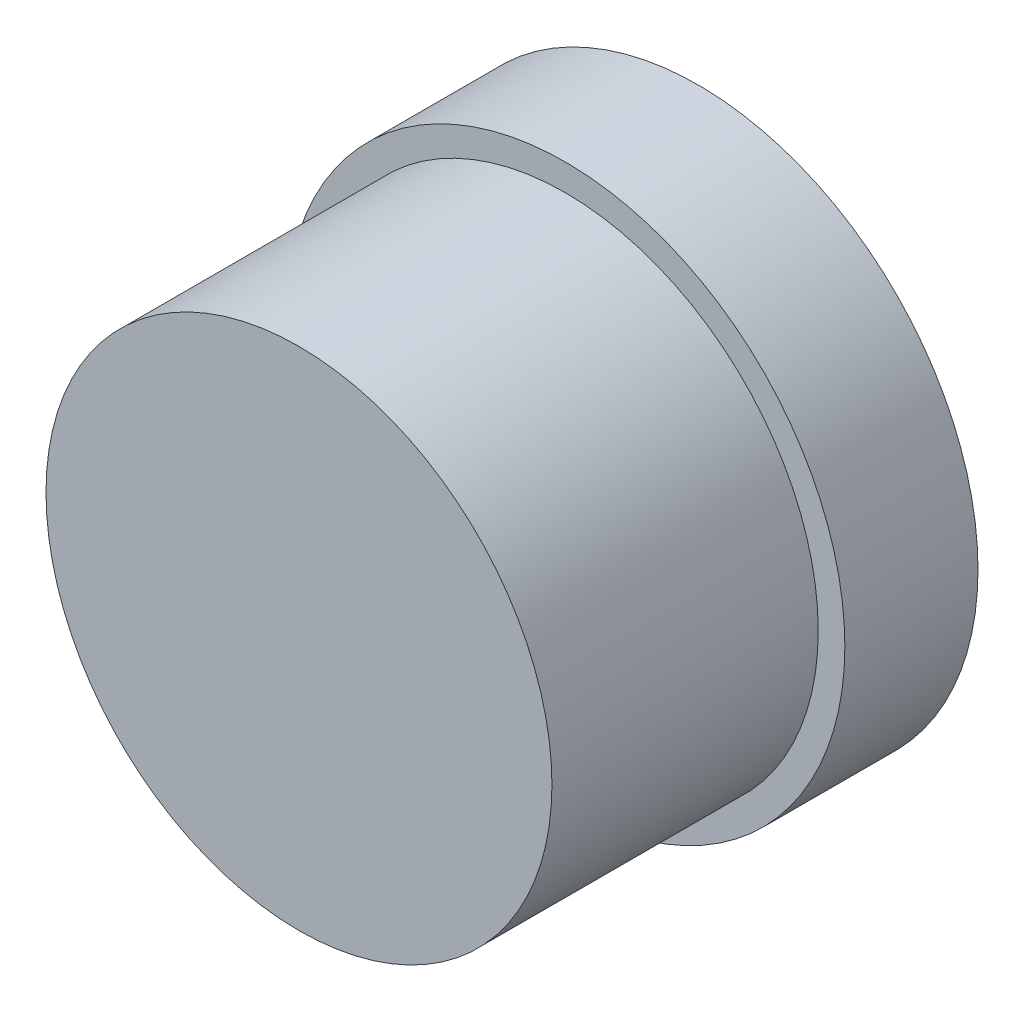
from build123d import *

# Parameters (mm, degrees)
SKETCH2_R           = 210
BOSS_EXTRUDE1_DEPTH = 100
SKETCH3_R           = 190
BOSS_EXTRUDE2_DEPTH = 200


with BuildPart() as part:
    # Sketch2 → Boss-Extrude1 (new body)
    with BuildSketch(Plane.XY):
        Circle(SKETCH2_R)
    extrude(amount=BOSS_EXTRUDE1_DEPTH)

    # Sketch3 → Boss-Extrude2 (add)
    with BuildSketch(Plane.XY.offset(100)):
        Circle(SKETCH3_R)
    extrude(amount=BOSS_EXTRUDE2_DEPTH)


solid = part.part
